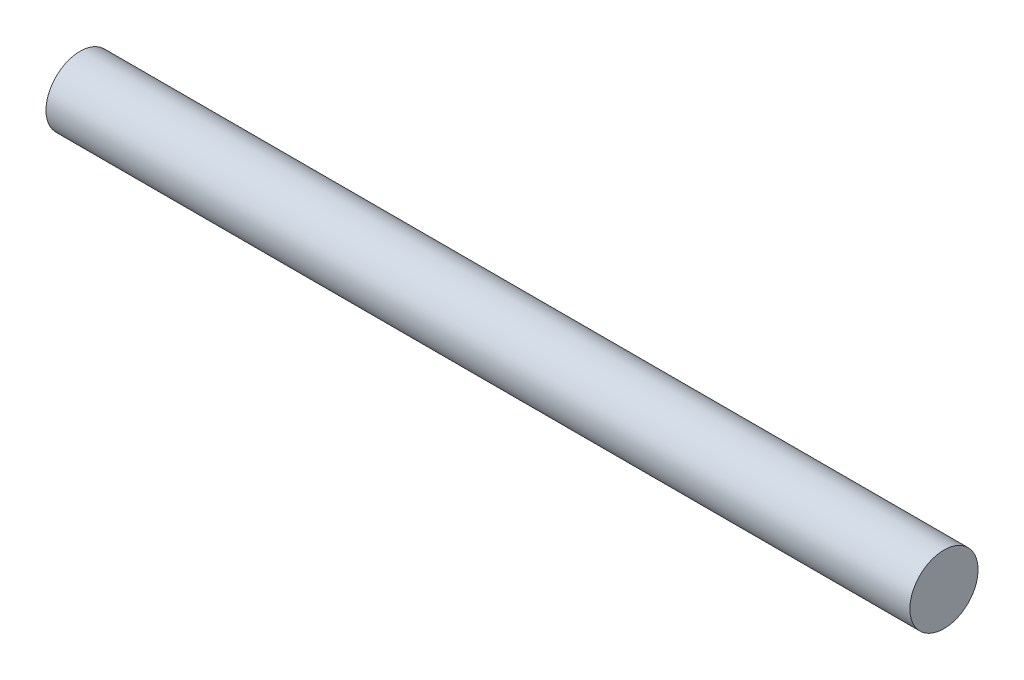
from build123d import *

# Parameters (mm, degrees)
SKETCH1_R           = 4.7625
BOSS_EXTRUDE1_DEPTH = 120.65


with BuildPart() as part:
    # Sketch1 → Boss-Extrude1 (new body)
    with BuildSketch(Plane(origin=(0, 0, 0), x_dir=(0, 0, -1), z_dir=(1, 0, 0))):
        with Locations(Location((0, 0, 0), (0, 0, 180))):
            Circle(SKETCH1_R)
    extrude(amount=BOSS_EXTRUDE1_DEPTH)


solid = part.part
